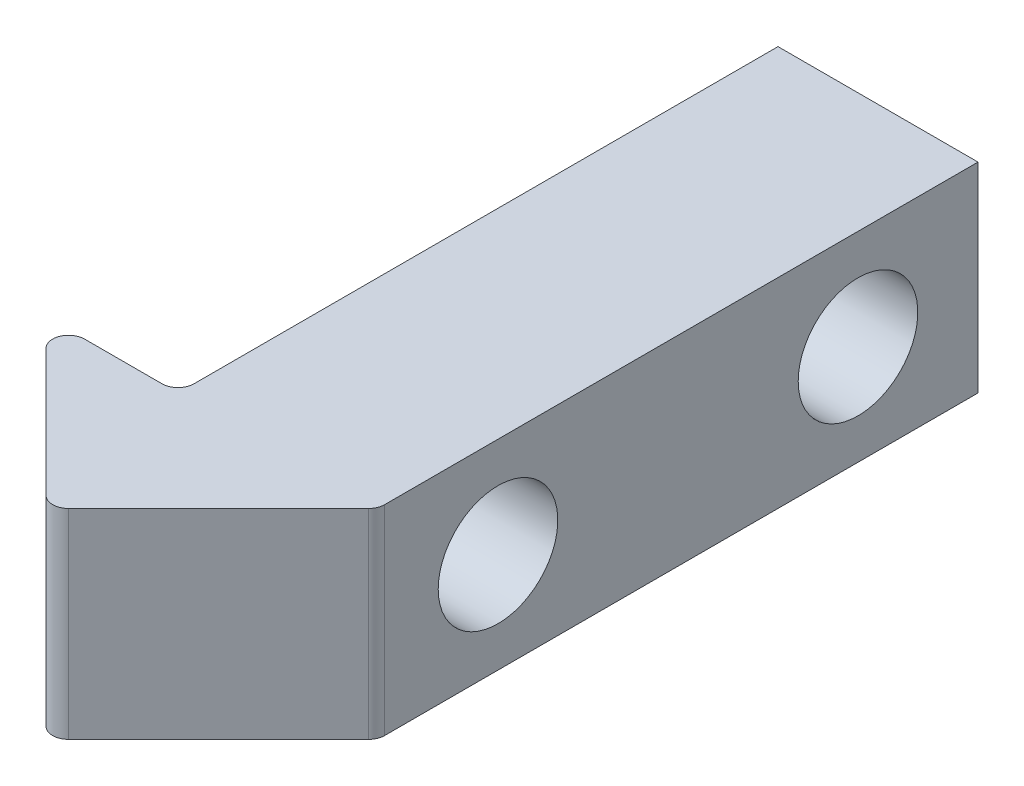
from build123d import *

# Parameters (mm, degrees)
BOSS_EXTRUDE1_DEPTH       = 6.35
F_6_CLEARANCE_HOLE1_D     = 3.7973
F_6_CLEARANCE_HOLE1_DEPTH = 6.733175986
F_6_CLEARANCE_HOLE1_TIP   = 1.140824014
FILLET1_R                 = 0.508


with BuildPart() as part:
    # Sketch1 → Boss-Extrude1 (new body)
    with BuildSketch(Plane(origin=(0, 0, 0), x_dir=(1, 0, 0), z_dir=(0, 1, 0))):
        Polygon((11.567845271, -11.620817646), (16.838662917, -6.35), (16.838662917, 12.7), (10.488662917, 12.7), (10.488662917, -6.35), (6.297027625, -6.35), align=None)
    extrude(amount=BOSS_EXTRUDE1_DEPTH)

    # #6 Clearance Hole1
    with Locations(Plane.ZY.offset(-10.488662917)):
        with Locations((-8.89, 3.175), (2.54, 3.175)):
            Hole(F_6_CLEARANCE_HOLE1_D / 2, depth=F_6_CLEARANCE_HOLE1_DEPTH)
            with Locations((0, 0, -(F_6_CLEARANCE_HOLE1_DEPTH + F_6_CLEARANCE_HOLE1_TIP / 2))):  # 118° drill point
                Cone(0, F_6_CLEARANCE_HOLE1_D / 2, F_6_CLEARANCE_HOLE1_TIP, mode=Mode.SUBTRACT)

    # Fillet1
    fillet1_edges = [part.edges().sort_by_distance(p)[0] for p in [
        (6.297027625, 3.175, 6.35),
        (10.488662917, 3.175, 6.35),
        (16.838662917, 3.175, 6.35),
        (11.567845271, 3.175, 11.620817646),
    ]]
    fillet(fillet1_edges, radius=FILLET1_R)


solid = part.part
